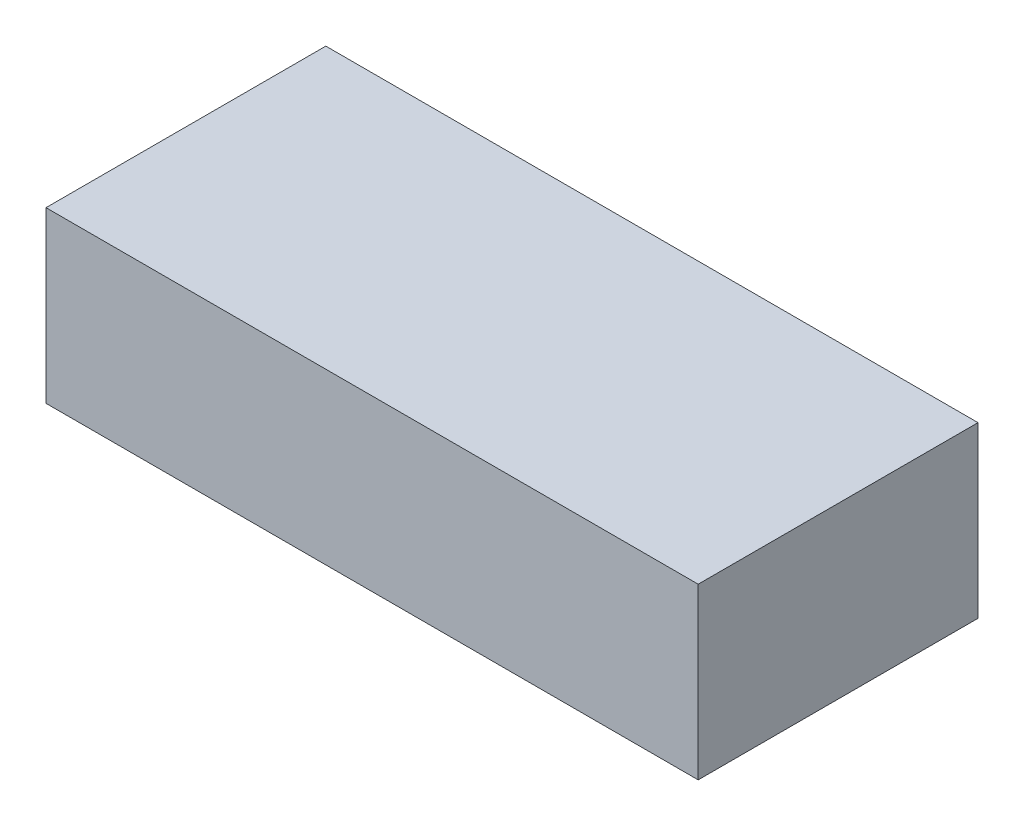
from build123d import *

# Parameters (mm, degrees)
SKETCH1_W           = 76.962
SKETCH1_H           = 33.02
BOSS_EXTRUDE1_DEPTH = 19.999999878


with BuildPart() as part:
    # Sketch1 → Boss-Extrude1 (new body)
    with BuildSketch(Plane(origin=(0, 0, 0), x_dir=(1, 0, 0), z_dir=(0, 1, 0))):
        Rectangle(SKETCH1_W, SKETCH1_H)
    extrude(amount=BOSS_EXTRUDE1_DEPTH)


solid = part.part
